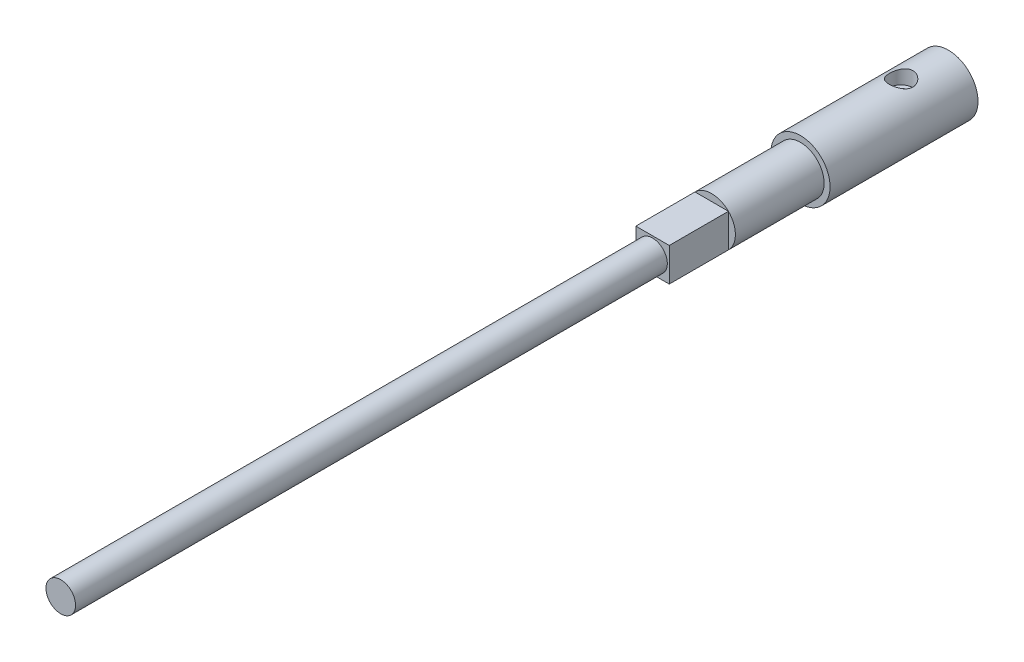
from build123d import *

# Parameters (mm, degrees)
CROQUIS1_R                 = 5
SALIENTE_EXTRUIR1_DEPTH    = 12.5
CROQUIS2_R                 = 2
CORTAR_EXTRUIR1_DEPTH      = 15.5
CROQUIS3_R                 = 2
CORTAR_EXTRUIR2_DEPTH      = 2.5
CROQUIS4_R                 = 4
SALIENTE_EXTRUIR2_DEPTH    = 15
CROQUIS5_W                 = 5.65685425
CROQUIS5_H                 = 5.65685425
SALIENTE_EXTRUIR3_DEPTH    = 10
CORTAR_EXTRUIR3_REACH      = 40.568
CORTAR_EXTRUIR3_END_RADIUS = 2
CROQUIS6_R                 = 1.265
CROQUIS7_W                 = 4
CROQUIS7_H                 = 10
CORTAR_EXTRUIR4_DEPTH      = 2
CROQUIS8_R                 = 2.5
SALIENTE_EXTRUIR4_DEPTH    = 100


with BuildPart() as part:
    # Croquis1 → Saliente-Extruir1 (new, symmetric)
    with BuildSketch(Plane.XY):
        Circle(CROQUIS1_R)
    extrude(amount=SALIENTE_EXTRUIR1_DEPTH, both=True)

    # Croquis2 → Cortar-Extruir1 (cut)
    with BuildSketch(Plane(origin=(0, 0, -12.5), x_dir=(-1, 0, 0), z_dir=(0, 0, -1))):
        Circle(CROQUIS2_R)
    extrude(amount=-CORTAR_EXTRUIR1_DEPTH, mode=Mode.SUBTRACT)

    # Croquis3 → Cortar-Extruir2 (cut)
    with BuildSketch(Plane(origin=(0, 5, 0), x_dir=(1, 0, 0), z_dir=(0, 1, 0))):
        with Locations(Location((0, 4.5, 0), (0, 0, 270))):
            Circle(CROQUIS3_R)
    extrude(amount=-CORTAR_EXTRUIR2_DEPTH, mode=Mode.SUBTRACT)

    # Croquis4 → Saliente-Extruir2 (add)
    with BuildSketch(Plane.XY.offset(12.5)):
        Circle(CROQUIS4_R)
    extrude(amount=SALIENTE_EXTRUIR2_DEPTH)

    # Croquis5 → Saliente-Extruir3 (add)
    with BuildSketch(Plane.XY.offset(27.5)):
        Rectangle(CROQUIS5_W, CROQUIS5_H)
    extrude(amount=SALIENTE_EXTRUIR3_DEPTH)

    # Cortar-Extruir3: up to this cylinder (the profile starts outside it)
    cortar_extruir3_end = Plane(origin=(0, 0, -4.5), z_dir=(0, 0, -1)) * Cylinder(CORTAR_EXTRUIR3_END_RADIUS, 86.136, mode=Mode.PRIVATE)
    # Croquis6 → Cortar-Extruir3 (cut, up to the surface)
    with BuildSketch(Plane(origin=(0, 2.5, 0), x_dir=(1, 0, 0), z_dir=(0, 1, 0)), mode=Mode.PRIVATE) as cortar_extruir3_sk1:
        with Locations(Location((0, 4.5, 0), (0, 0, 270))):
            Circle(CROQUIS6_R)
    cortar_extruir3_tool1 = extrude(cortar_extruir3_sk1.sketch, amount=-CORTAR_EXTRUIR3_REACH, mode=Mode.PRIVATE) - cortar_extruir3_end
    add(cortar_extruir3_tool1.solids().sort_by_distance((0, 2.5, -4.5))[0], mode=Mode.SUBTRACT)

    # Croquis7 → Cortar-Extruir4 (cut)
    with BuildSketch(Plane(origin=(0, -5, 0), x_dir=(-1, 0, 0), z_dir=(0, -1, 0))):
        Rectangle(CROQUIS7_W, CROQUIS7_H)
    extrude(amount=-CORTAR_EXTRUIR4_DEPTH, mode=Mode.SUBTRACT)

    # Croquis8 → Saliente-Extruir4 (add)
    with BuildSketch(Plane.XY.offset(37.5)):
        Circle(CROQUIS8_R)
    extrude(amount=SALIENTE_EXTRUIR4_DEPTH)


solid = part.part
